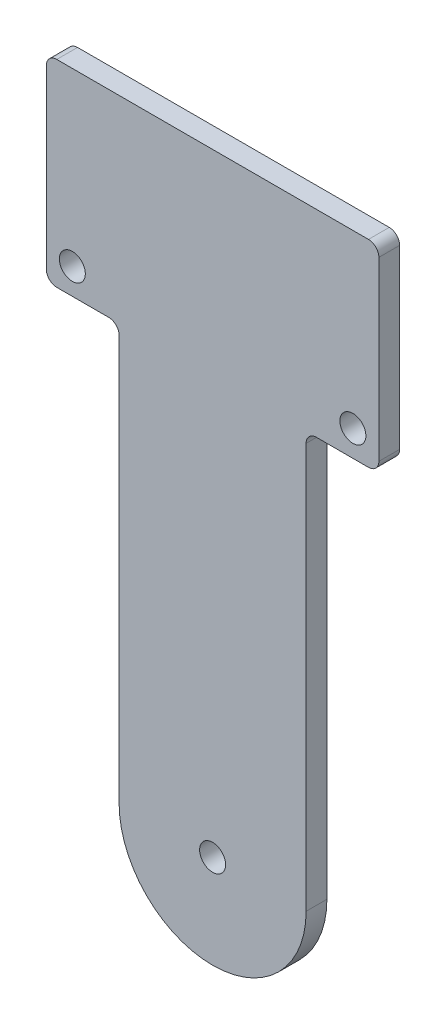
from build123d import *

# Parameters (mm, degrees)
SKETCH_1_R      = 1.25
EXTRUDE_1_DEPTH = 2


with BuildPart() as part:
    # 草圖1 → 填料-伸長1 (new body)
    with BuildSketch(Plane.XY):
        with BuildLine():
            Line((18.048613933, -20.404186252), (23.048613933, -20.404186252))
            ThreePointArc((23.048613933, -20.404186252), (23.755720714, -20.111293033), (24.048613933, -19.404186252))
            Line((24.048613933, -19.404186252), (24.048613933, -15.404186252))
            Line((24.048613933, -15.404186252), (24.048613933, -2.404186252))
            ThreePointArc((24.048613933, -2.404186252), (23.755720714, -1.697079471), (23.048613933, -1.404186252))
            Line((23.048613933, -1.404186252), (-6.951386067, -1.404186252))
            ThreePointArc((-6.951386067, -1.404186252), (-7.658492848, -1.697079471), (-7.951386067, -2.404186252))
            Line((-7.951386067, -2.404186252), (-7.951386067, -15.404186252))
            Line((-7.951386067, -15.404186252), (-7.951386067, -19.404186252))
            ThreePointArc((-7.951386067, -19.404186252), (-7.658492848, -20.111293033), (-6.951386067, -20.404186252))
            Line((-6.951386067, -20.404186252), (-1.951386067, -20.404186252))
            ThreePointArc((-1.951386067, -20.404186252), (-1.244279286, -20.697079471), (-0.951386067, -21.404186252))
            Line((-0.951386067, -21.404186252), (-0.951386067, -60.404186252))
            ThreePointArc((-0.951386067, -60.404186252), (8.048613933, -69.404186252), (17.048613933, -60.404186252))
            Line((17.048613933, -60.404186252), (17.048613933, -21.404186252))
            ThreePointArc((17.048613933, -21.404186252), (17.341507152, -20.697079471), (18.048613933, -20.404186252))
        make_face()
        with Locations((8.048613933, -60.404186252)):
            Circle(SKETCH_1_R, mode=Mode.SUBTRACT)
        with Locations((-5.451386067, -17.904186252)):
            Circle(SKETCH_1_R, mode=Mode.SUBTRACT)
        with Locations((21.548613933, -17.904186252)):
            Circle(SKETCH_1_R, mode=Mode.SUBTRACT)
    extrude(amount=EXTRUDE_1_DEPTH)


solid = part.part
